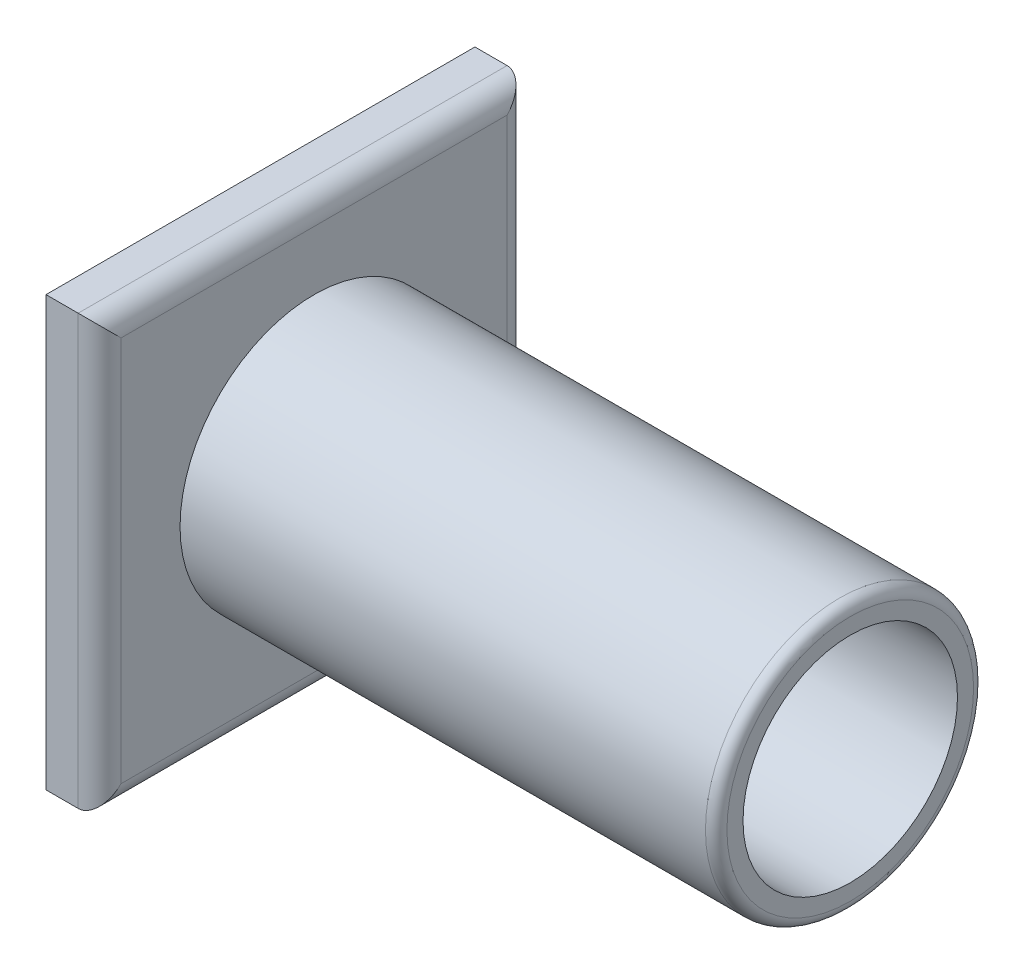
from build123d import *

# Parameters (mm, degrees)
SKETCH3_W           = 800
SKETCH3_H           = 800
BOSS_EXTRUDE1_DEPTH = 100
SKETCH4_R           = 250
SKETCH4_R_2         = 200
BOSS_EXTRUDE2_DEPTH = 1000
FILLET3_R           = 40
FILLET4_R           = 20


with BuildPart() as part:
    # Sketch3 → Boss-Extrude1 (new body)
    with BuildSketch(Plane(origin=(0, 0, 0), x_dir=(0, 0, -1), z_dir=(1, 0, 0))):
        Rectangle(SKETCH3_W, SKETCH3_H)
    extrude(amount=BOSS_EXTRUDE1_DEPTH)

    # Sketch4 → Boss-Extrude2 (add)
    with BuildSketch(Plane(origin=(100, 0, 0), x_dir=(0, 0, -1), z_dir=(1, 0, 0))):
        with Locations(Location((0, 0, 0), (0, 0, 180))):
            Circle(SKETCH4_R)
        Circle(SKETCH4_R_2, mode=Mode.SUBTRACT)
    extrude(amount=BOSS_EXTRUDE2_DEPTH)

    # Fillet3
    fillet3_edges = [part.edges().sort_by_distance(p)[0] for p in [
        (100, 0, 400),
        (100, -400, 0),
        (100, 0, -400),
        (100, 400, 0),
    ]]
    fillet(fillet3_edges, radius=FILLET3_R)

    # Fillet4
    fillet4_edges = [part.edges().sort_by_distance(p)[0] for p in [
        (1100, 0, -250),
    ]]
    fillet(fillet4_edges, radius=FILLET4_R)


solid = part.part
